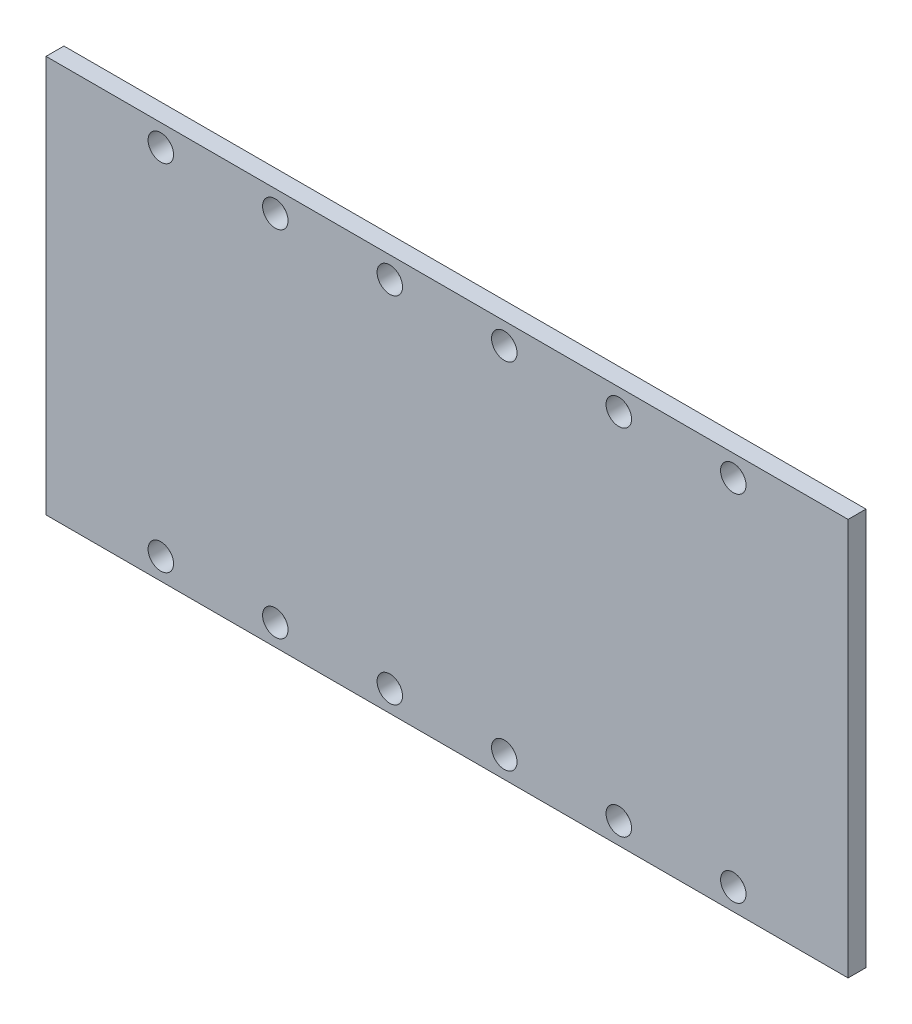
from build123d import *

# Parameters (mm, degrees)
SKETCH1_W           = 71.1708
SKETCH1_H           = 35.2425
BOSS_EXTRUDE1_DEPTH = 1.5875
LPATTERN1_COUNT     = 6
LPATTERN1_PITCH     = 10.16


with BuildPart() as part:
    # Sketch1 → Boss-Extrude1 (new body)
    with BuildSketch(Plane.XY):
        Rectangle(SKETCH1_W, SKETCH1_H)
    extrude(amount=BOSS_EXTRUDE1_DEPTH)

    # Sketch3 → #2 Clearance Hole1 (revolve, cut)
    with BuildSketch(Plane(origin=(-25.4, 15.71625, 1.5875), x_dir=(0, -1, 0), z_dir=(1, 0, 0))):
        Polygon((0, 0), (0, 3.854152758), (1.1303, 3.175), (1.1303, 0), align=None)
    f_2_clearance_hole1 = revolve(axis=Axis((-25.4, 15.71625, 7.9375), (0, 0, -1)), mode=Mode.SUBTRACT)

    # LPattern1: #2 Clearance Hole1 ×6
    with Locations(*[(i * LPATTERN1_PITCH, 0, 0) for i in range(1, LPATTERN1_COUNT)]):
        add(f_2_clearance_hole1, mode=Mode.SUBTRACT)

    # Mirror1: #2 Clearance Hole1 across plane
    add(f_2_clearance_hole1.mirror(Plane.ZX), mode=Mode.SUBTRACT)

    # Mirror1 copy 1 sketch → Mirror1 copy 1 (revolve, cut)
    with BuildSketch(Plane(origin=(-15.24, -15.71625, 1.5875), x_dir=(0, 1, 0), z_dir=(1, 0, 0))):
        Polygon((0, 0), (0, -3.854152758), (1.1303, -3.175), (1.1303, 0), align=None)
    revolve(axis=Axis((-15.24, -15.71625, 7.9375), (0, 0, 1)), mode=Mode.SUBTRACT)

    # Mirror1 copy 2 sketch → Mirror1 copy 2 (revolve, cut)
    with BuildSketch(Plane(origin=(-5.08, -15.71625, 1.5875), x_dir=(0, 1, 0), z_dir=(1, 0, 0))):
        Polygon((0, 0), (0, -3.854152758), (1.1303, -3.175), (1.1303, 0), align=None)
    revolve(axis=Axis((-5.08, -15.71625, 7.9375), (0, 0, 1)), mode=Mode.SUBTRACT)

    # Mirror1 copy 3 sketch → Mirror1 copy 3 (revolve, cut)
    with BuildSketch(Plane(origin=(5.08, -15.71625, 1.5875), x_dir=(0, 1, 0), z_dir=(1, 0, 0))):
        Polygon((0, 0), (0, -3.854152758), (1.1303, -3.175), (1.1303, 0), align=None)
    revolve(axis=Axis((5.08, -15.71625, 7.9375), (0, 0, 1)), mode=Mode.SUBTRACT)

    # Mirror1 copy 4 sketch → Mirror1 copy 4 (revolve, cut)
    with BuildSketch(Plane(origin=(15.24, -15.71625, 1.5875), x_dir=(0, 1, 0), z_dir=(1, 0, 0))):
        Polygon((0, 0), (0, -3.854152758), (1.1303, -3.175), (1.1303, 0), align=None)
    revolve(axis=Axis((15.24, -15.71625, 7.9375), (0, 0, 1)), mode=Mode.SUBTRACT)

    # Mirror1 copy 5 sketch → Mirror1 copy 5 (revolve, cut)
    with BuildSketch(Plane(origin=(25.4, -15.71625, 1.5875), x_dir=(0, 1, 0), z_dir=(1, 0, 0))):
        Polygon((0, 0), (0, -3.854152758), (1.1303, -3.175), (1.1303, 0), align=None)
    revolve(axis=Axis((25.4, -15.71625, 7.9375), (0, 0, 1)), mode=Mode.SUBTRACT)


solid = part.part
